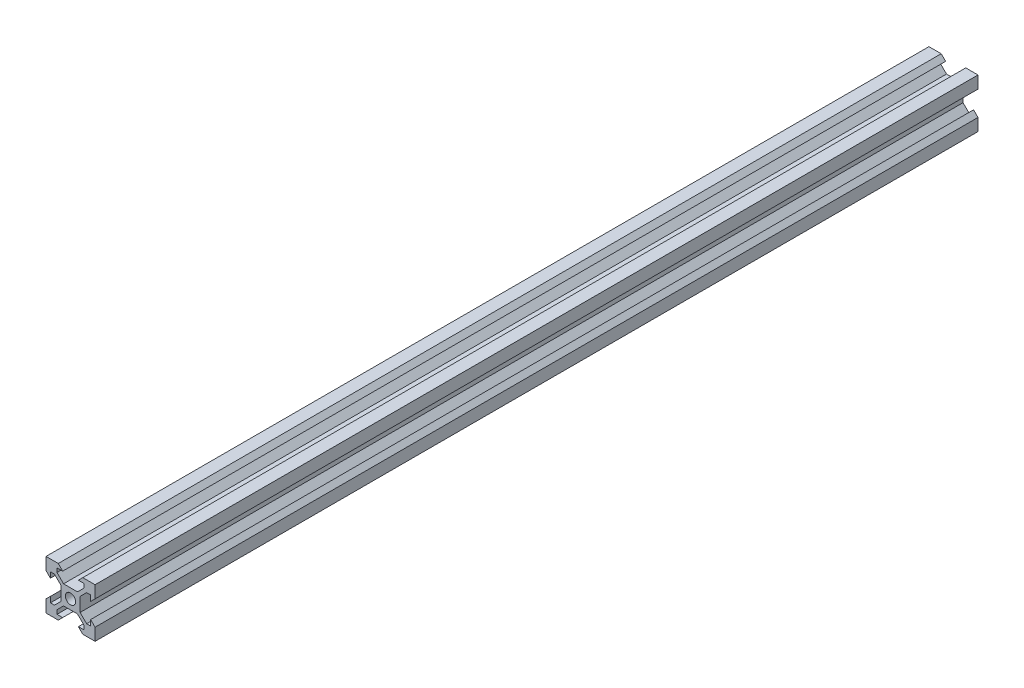
from build123d import *

# Parameters (mm, degrees)
SKETCH1_R           = 2.1
BOSS_EXTRUDE1_DEPTH = 360


with BuildPart() as part:
    # Sketch1 → Boss-Extrude1 (new body)
    with BuildSketch(Plane.XY):
        Polygon((-10, 10), (-10, 5), (-8.2, 3.2), (-8.2, 5.499339828), (-6.56, 5.499339828), (-3.900660172, 2.84), (-3.900660172, -2.84), (-6.56, -5.499339828), (-8.2, -5.499339828), (-8.2, -3.2), (-10, -5), (-10, -10), (-5, -10), (-3.2, -8.2), (-5.499339828, -8.2), (-5.499339828, -6.56), (-2.84, -3.900660172), (2.84, -3.900660172), (5.499339828, -6.56), (5.499339828, -8.2), (3.2, -8.2), (5, -10), (10, -10), (10, -5), (8.2, -3.2), (8.2, -5.499339828), (6.56, -5.499339828), (3.900660172, -2.84), (3.900660172, 2.84), (6.56, 5.499339828), (8.2, 5.499339828), (8.2, 3.2), (10, 5), (10, 10), (5, 10), (3.2, 8.2), (5.499339828, 8.2), (5.499339828, 6.56), (2.84, 3.900660172), (-2.84, 3.900660172), (-5.499339828, 6.56), (-5.499339828, 8.2), (-3.2, 8.2), (-5, 10), align=None)
        Circle(SKETCH1_R, mode=Mode.SUBTRACT)
    extrude(amount=-BOSS_EXTRUDE1_DEPTH)


solid = part.part
